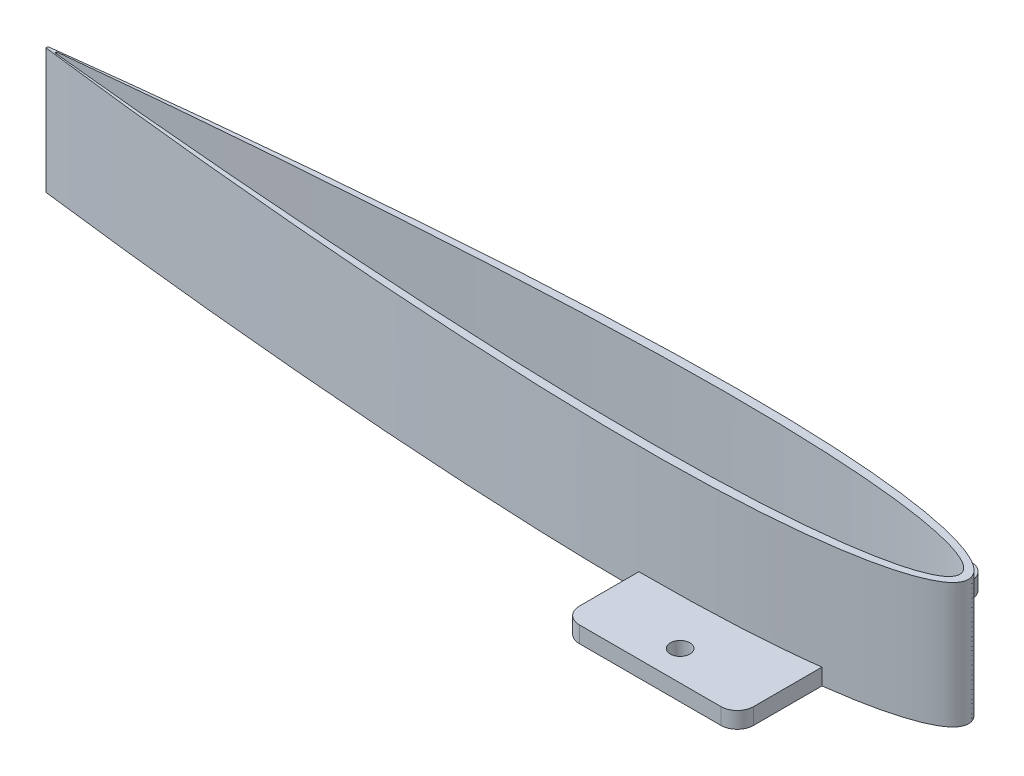
from build123d import *

# Parameters (mm, degrees)
BOSS_EXTRUDE1_DEPTH = 23
BOSS_EXTRUDE2_DEPTH = 3
CUT_EXTRUDE1_DEPTH  = 20
SKETCH4_R           = 1.8
CUT_EXTRUDE2_DEPTH  = 3


with BuildPart() as part:
    # Sketch1 → Boss-Extrude1 (new body)
    with BuildSketch(Plane(origin=(0, 0, 0), x_dir=(1, 0, 0), z_dir=(0, 1, 0))):
        with BuildLine():
            Line((-167.725, 0.190588125), (-167.725, -0.190588125))
            add(Edge.make_bspline(
                [(-167.725, 0.190588125), (-167.570404846, 0.209944797), (-166.953765666, 0.287153444), (-165.572669682, 0.458755656), (-163.287655017, 0.739010388), (-160.123718034, 1.11947731), (-156.115504683, 1.589372626), (-151.306906515, 2.135975866), (-145.750597128, 2.745359221), (-139.507451331, 3.402846646), (-132.645878462, 4.093336129), (-125.241068238, 4.801386488), (-117.374161326, 5.511120515), (-109.13135356, 6.20600886), (-100.602944876, 6.868643624), (-91.88234439, 7.48062042), (-83.065043705, 8.022638187), (-74.24757073, 8.474892101), (-65.526435651, 8.817783547), (-56.997079771, 9.032909752), (-48.75283402, 9.104237197), (-40.883897372, 9.01931098), (-33.47631992, 8.7703417), (-26.611046039, 8.354960902), (-20.362804897, 7.776646701), (-14.799449756, 7.044294828), (-9.979548808, 6.172358196), (-5.95417922, 5.177149754), (-2.752877473, 4.081889531), (-0.403062268, 2.890057882), (1.15931636, 1.602755026), (1.790699794, 0), (1.15931636, -1.602755026), (-0.403062268, -2.890057882), (-2.752877473, -4.081889531), (-5.95417922, -5.177149754), (-9.979548808, -6.172358196), (-14.799449756, -7.044294828), (-20.362804897, -7.776646701), (-26.611046039, -8.354960902), (-33.47631992, -8.7703417), (-40.883897372, -9.01931098), (-48.75283402, -9.104237197), (-56.997079771, -9.032909752), (-65.526435651, -8.817783547), (-74.24757073, -8.474892101), (-83.065043705, -8.022638187), (-91.88234439, -7.48062042), (-100.602944876, -6.868643624), (-109.13135356, -6.20600886), (-117.374161326, -5.511120515), (-125.241068238, -4.801386488), (-132.645878462, -4.093336129), (-139.507451331, -3.402846646), (-145.750597128, -2.745359221), (-151.306906515, -2.135975866), (-156.115504683, -1.589372626), (-160.123718034, -1.11947731), (-163.287655017, -0.739010388), (-165.572669682, -0.458755656), (-166.953765666, -0.287153444), (-167.570404846, -0.209944797), (-167.725, -0.190588125)],
                knots=[0, 0, 0, 0, 0.001358405, 0.00541832, 0.012134061, 0.021430217, 0.033202687, 0.047320053, 0.063625218, 0.081937265, 0.102053501, 0.123751675, 0.14679236, 0.170921535, 0.19587336, 0.221373172, 0.247140696, 0.272893449, 0.29835028, 0.323234971, 0.347279788, 0.370228879, 0.391841445, 0.411894702, 0.430186779, 0.446539945, 0.460805006, 0.472868718, 0.482668893, 0.490231031, 0.495772613, 0.5, 0.504227387, 0.509768969, 0.517331107, 0.527131282, 0.539194994, 0.553460055, 0.569813221, 0.588105298, 0.608158555, 0.629771121, 0.652720212, 0.676765029, 0.70164972, 0.727106551, 0.752859304, 0.778626828, 0.80412664, 0.829078465, 0.85320764, 0.876248325, 0.897946499, 0.918062735, 0.936374782, 0.952679947, 0.966797313, 0.978569783, 0.987865939, 0.99458168, 0.998641595, 1, 1, 1, 1], degree=3))
        make_face()
    extrude(amount=BOSS_EXTRUDE1_DEPTH)

    # Sketch2 → Boss-Extrude2 (add)
    with BuildSketch(Plane(origin=(0, 0, 0), x_dir=(1, 0, 0), z_dir=(0, 1, 0))):
        with BuildLine():
            Line((-46.9, -23), (-20.9, -23))
            ThreePointArc((-20.9, -23), (-18.778679656, -22.121320344), (-17.9, -20))
            Line((-17.9, -20), (-17.9, 20))
            ThreePointArc((-17.9, 20), (-18.778679656, 22.121320344), (-20.9, 23))
            Line((-20.9, 23), (-46.9, 23))
            ThreePointArc((-46.9, 23), (-49.021320344, 22.121320344), (-49.9, 20))
            Line((-49.9, 20), (-49.9, -20))
            ThreePointArc((-49.9, -20), (-49.021320344, -22.121320344), (-46.9, -23))
        make_face()
    extrude(amount=BOSS_EXTRUDE2_DEPTH)

    # Sketch3 → Cut-Extrude1 (cut)
    with BuildSketch(Plane(origin=(0, 23, 0), x_dir=(1, 0, 0), z_dir=(0, 1, 0))):
        with BuildLine():
            Line((-166.125, 0.156988125), (-166.125, -0.156988125))
            add(Edge.make_bspline(
                [(-166.125, 0.156988125), (-165.973326037, 0.172932331), (-165.368325064, 0.236530989), (-164.013292597, 0.377884196), (-161.771401847, 0.608737032), (-158.667188494, 0.922135759), (-154.734649863, 1.309196972), (-150.016855497, 1.759441942), (-144.565487316, 2.261397922), (-138.440270772, 2.802976133), (-131.70832067, 3.371737186), (-124.443402607, 3.954962388), (-116.725120873, 4.539573791), (-108.638041586, 5.111956023), (-100.270761544, 5.657769717), (-91.714933702, 6.161854392), (-83.064260756, 6.608310901), (-74.413468596, 6.980825485), (-65.857270897, 7.263255344), (-57.489335841, 7.440444342), (-49.401262085, 7.499191705), (-41.6815774, 7.429245171), (-34.414741782, 7.224212382), (-27.680232998, 6.882137969), (-21.551445773, 6.406025549), (-16.09522307, 5.802984307), (-11.369207596, 5.086048974), (-7.424992006, 4.266381397), (-4.291451458, 3.372152429), (-2.002111001, 2.39035369), (-0.476995582, 1.376031107), (0.197203022, 0), (-0.476995582, -1.376031107), (-2.002111001, -2.39035369), (-4.291451458, -3.372152429), (-7.424992006, -4.266381397), (-11.369207596, -5.086048974), (-16.09522307, -5.802984307), (-21.551445773, -6.406025549), (-27.680232998, -6.882137969), (-34.414741782, -7.224212382), (-41.6815774, -7.429245171), (-49.401262085, -7.499191705), (-57.489335841, -7.440444342), (-65.857270897, -7.263255344), (-74.413468596, -6.980825485), (-83.064260756, -6.608310901), (-91.714933702, -6.161854392), (-100.270761544, -5.657769717), (-108.638041586, -5.111956023), (-116.725120873, -4.539573791), (-124.443402607, -3.954962388), (-131.70832067, -3.371737186), (-138.440270772, -2.802976133), (-144.565487316, -2.261397922), (-150.016855497, -1.759441942), (-154.734649863, -1.309196972), (-158.667188494, -0.922135759), (-161.771401847, -0.608737032), (-164.013292597, -0.377884196), (-165.368325064, -0.236530989), (-165.973326037, -0.172932331), (-166.125, -0.156988125)],
                knots=[0, 0, 0, 0, 0.001360811, 0.005428038, 0.012156267, 0.021470482, 0.03326704, 0.047414968, 0.063757539, 0.082114088, 0.102282038, 0.12403911, 0.147145729, 0.171347612, 0.196378555, 0.221963406, 0.247821218, 0.273668571, 0.299222988, 0.324206394, 0.348348543, 0.371390297, 0.393086736, 0.413210068, 0.431552463, 0.44792908, 0.462181893, 0.474185722, 0.483860131, 0.491198837, 0.496361358, 0.5, 0.503638642, 0.508801163, 0.516139869, 0.525814278, 0.537818107, 0.55207092, 0.568447537, 0.586789932, 0.606913264, 0.628609703, 0.651651457, 0.675793606, 0.700777012, 0.726331429, 0.752178782, 0.778036594, 0.803621445, 0.828652388, 0.852854271, 0.87596089, 0.897717962, 0.917885912, 0.936242461, 0.952585032, 0.96673296, 0.978529518, 0.987843733, 0.994571962, 0.998639189, 1, 1, 1, 1], degree=3))
        make_face()
    extrude(amount=-CUT_EXTRUDE1_DEPTH, mode=Mode.SUBTRACT)

    # Sketch4 → Cut-Extrude2 (cut)
    with BuildSketch(Plane(origin=(0, 0, 0), x_dir=(1, 0, 0), z_dir=(0, 1, 0))):
        with Locations(Location((-33.9, -17.5, 0), (0, 0, 270))):
            Circle(SKETCH4_R)
        with Locations(Location((-33.9, 17.5, 0), (0, 0, 270))):
            Circle(SKETCH4_R)
    extrude(amount=CUT_EXTRUDE2_DEPTH, mode=Mode.SUBTRACT)


solid = part.part
